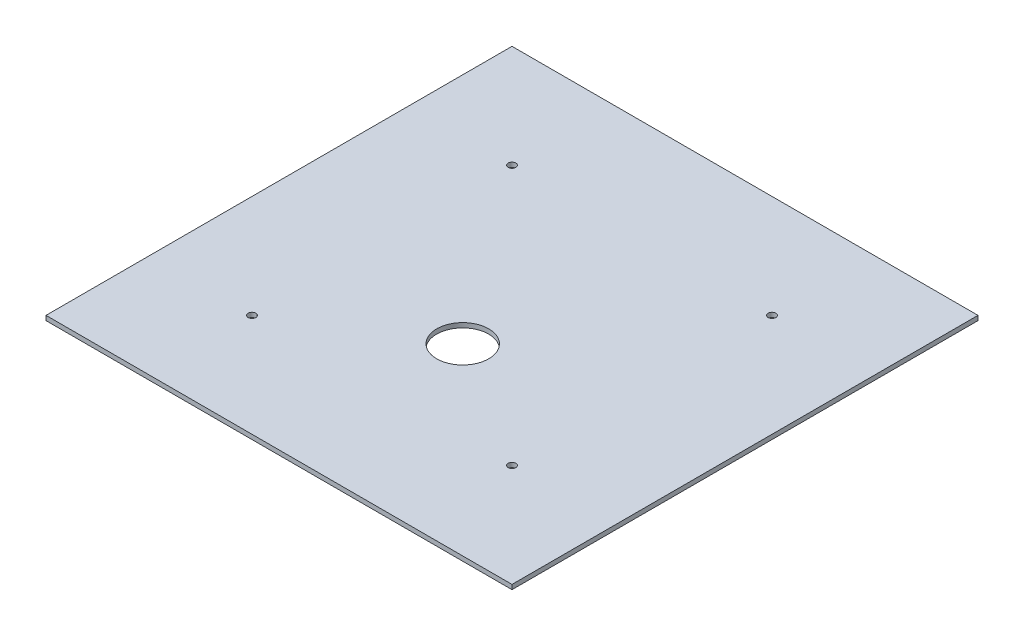
from build123d import *

# Parameters (mm, degrees)
SKETCH2_W           = 304.8
SKETCH2_H           = 304.8
BOSS_EXTRUDE1_DEPTH = 3
SKETCH3_R           = 2.5
CUT_EXTRUDE1_DEPTH  = 216.547025032
SKETCH4_R           = 17
CUT_EXTRUDE2_DEPTH  = 216.547025032


with BuildPart() as part:
    # Sketch2 → Boss-Extrude1 (new body)
    with BuildSketch(Plane(origin=(0, 0, 0), x_dir=(1, 0, 0), z_dir=(0, 1, 0))):
        Rectangle(SKETCH2_W, SKETCH2_H)
    extrude(amount=BOSS_EXTRUDE1_DEPTH)

    # Sketch3 → Cut-Extrude1 (cut, through all)
    with BuildSketch(Plane(origin=(0, 3, 0), x_dir=(1, 0, 0), z_dir=(0, 1, 0))):
        with Locations(Location((-85.035, 85.035, 0), (0, 0, 270))):
            Circle(SKETCH3_R)
        with Locations(Location((85.035, 85.035, 0), (0, 0, 270))):
            Circle(SKETCH3_R)
        with Locations(Location((-85.035, -85.035, 0), (0, 0, 270))):
            Circle(SKETCH3_R)
        with Locations(Location((85.035, -85.035, 0), (0, 0, 270))):
            Circle(SKETCH3_R)
    extrude(amount=-CUT_EXTRUDE1_DEPTH, mode=Mode.SUBTRACT)

    # Sketch4 → Cut-Extrude2 (cut, through all)
    with BuildSketch(Plane(origin=(0, 3, 0), x_dir=(1, 0, 0), z_dir=(0, 1, 0))):
        with Locations(Location((0, -32.24, 0), (0, 0, 270))):
            Circle(SKETCH4_R)
    extrude(amount=-CUT_EXTRUDE2_DEPTH, mode=Mode.SUBTRACT)


solid = part.part
